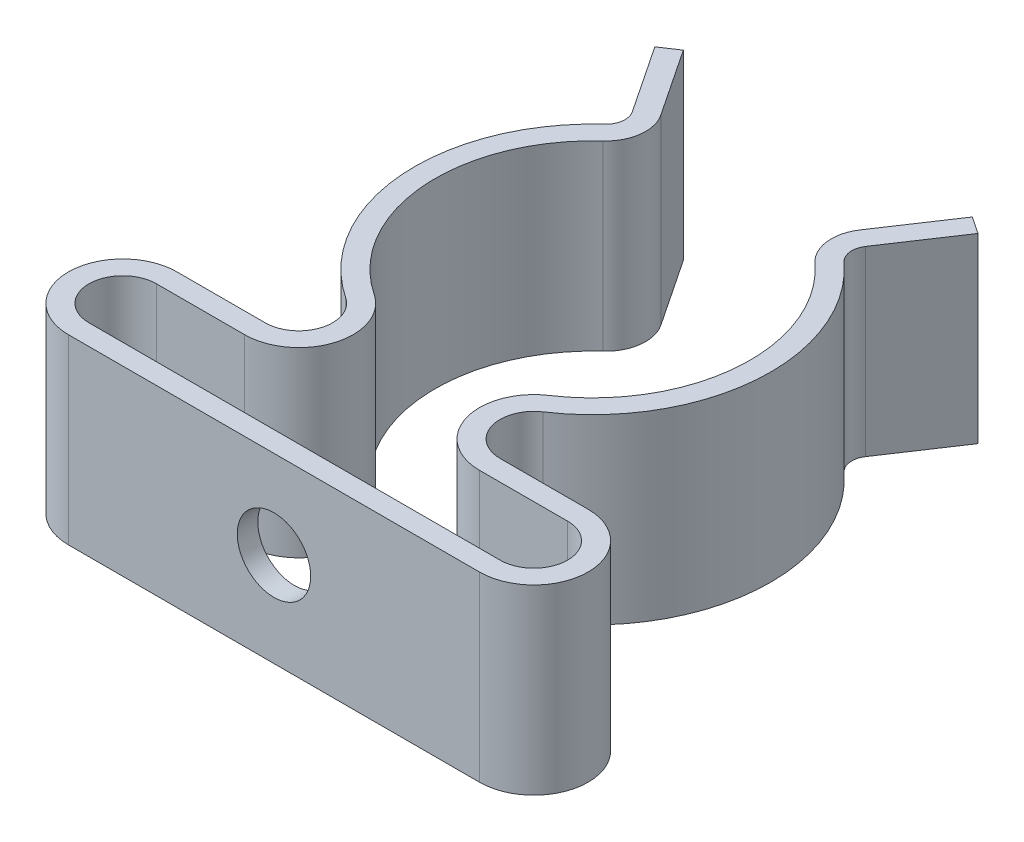
from build123d import *

# Parameters (mm, degrees)
EXTRUDE_THIN3_DEPTH      = 6
EXTRUDE_THIN3_DEPTH_BACK = 0.2
EXTRUDE1_REACH           = 23.681
SKETCH2_R                = 1.25


with BuildPart() as part:
    # Sketch1 → Extrude-Thin3 (new, two sides: drawn at the far end of the back side and taken through both)
    with BuildSketch(Plane(origin=(0, 0, 0), x_dir=(1, 0, 0), z_dir=(0, 1, 0)).offset(-EXTRUDE_THIN3_DEPTH_BACK)):
        with BuildLine():
            Line((-5.502320154, 18.122508758), (-3.972308472, 15.827491235))
            ThreePointArc((-3.972308472, 15.827491235), (-3.86802113, 15.387436777), (-4.076023457, 14.985866351))
            ThreePointArc((-4.076023457, 14.985866351), (-6.044162598, 10.047161593), (-3.362094774, 5.456857838))
            ThreePointArc((-3.362094774, 5.456857838), (-2.89934417, 4.166748229), (-4, 3.35))
            Line((-4, 3.35), (-7, 3.35))
            ThreePointArc((-7, 3.35), (-8.85, 1.5), (-7, -0.35))
            Line((-7, -0.35), (7, -0.35))
            ThreePointArc((7, -0.35), (8.85, 1.5), (7, 3.35))
            Line((7, 3.35), (4, 3.35))
            ThreePointArc((4, 3.35), (2.89934417, 4.166748229), (3.362094774, 5.456857838))
            ThreePointArc((3.362094774, 5.456857838), (6.044162598, 10.047161593), (4.076023457, 14.985866351))
            ThreePointArc((4.076023457, 14.985866351), (3.86802113, 15.387436777), (3.972308472, 15.827491235))
            Line((3.972308472, 15.827491235), (5.502320154, 18.122508758))
            Line((5.502320154, 18.122508758), (4.919884948, 18.510798895))
            Line((4.919884948, 18.510798895), (3.389873266, 16.215781372))
            ThreePointArc((3.389873266, 16.215781372), (3.17327648, 15.301822114), (3.605281311, 14.467791228))
            ThreePointArc((3.605281311, 14.467791228), (5.346119002, 10.099460144), (2.973804637, 6.039293045))
            ThreePointArc((2.973804637, 6.039293045), (2.229379751, 3.963899325), (4, 2.65))
            Line((4, 2.65), (7, 2.65))
            ThreePointArc((7, 2.65), (8.15, 1.5), (7, 0.35))
            Line((7, 0.35), (-7, 0.35))
            ThreePointArc((-7, 0.35), (-8.15, 1.5), (-7, 2.65))
            Line((-7, 2.65), (-4, 2.65))
            ThreePointArc((-4, 2.65), (-2.229379751, 3.963899325), (-2.973804637, 6.039293045))
            ThreePointArc((-2.973804637, 6.039293045), (-5.346119002, 10.099460144), (-3.605281311, 14.467791228))
            ThreePointArc((-3.605281311, 14.467791228), (-3.17327648, 15.301822114), (-3.389873266, 16.215781372))
            Line((-3.389873266, 16.215781372), (-4.919884948, 18.510798895))
            Line((-4.919884948, 18.510798895), (-5.502320154, 18.122508758))
        make_face()
    extrude(amount=EXTRUDE_THIN3_DEPTH + EXTRUDE_THIN3_DEPTH_BACK)

    # Sketch2 → Extrude1 (cut, up to next)
    with BuildSketch(Plane.XY.offset(0.35), mode=Mode.PRIVATE) as extrude1_sk1:
        with Locations((0, 3)):
            Circle(SKETCH2_R)
    extrude1_tool1 = extrude(extrude1_sk1.sketch, amount=-EXTRUDE1_REACH, mode=Mode.PRIVATE) & part.part
    add(extrude1_tool1.solids().sort_by_distance((0, 3, 0.35))[0], mode=Mode.SUBTRACT)


solid = part.part
